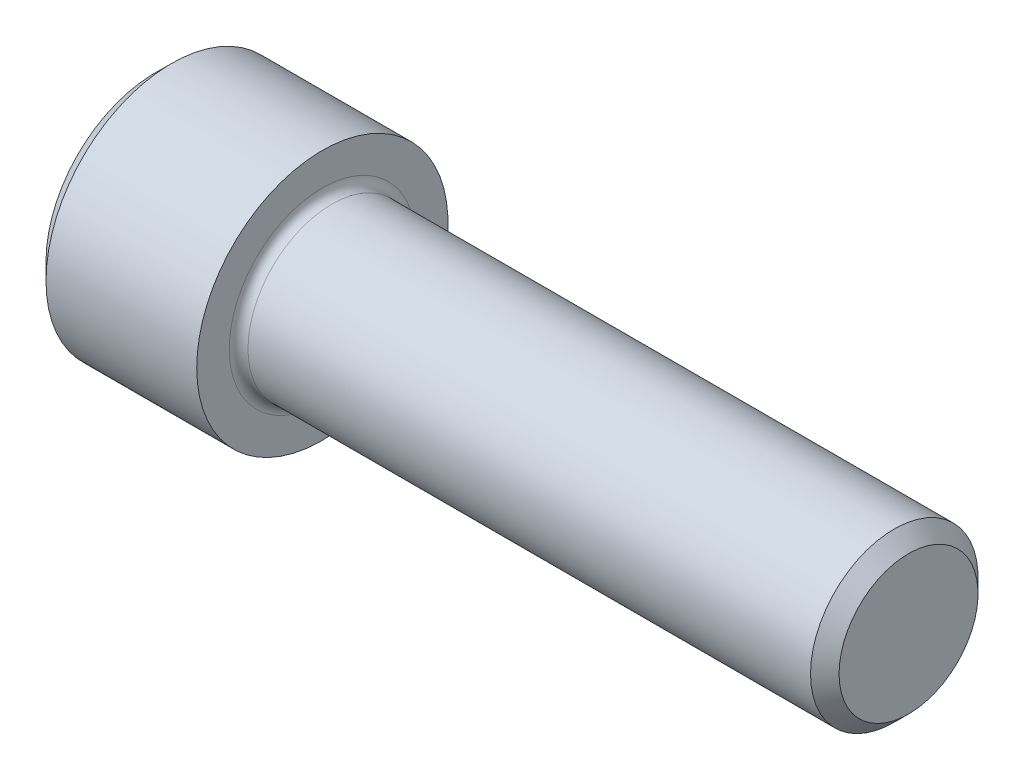
from build123d import *

# Parameters (mm, degrees)
FILLET1_R   = 0.3556
HEX_2_DEPTH = 3.048


with BuildPart() as part:
    # BodySke → Base-Revolve (revolve)
    with BuildSketch(Plane.XY, mode=Mode.PRIVATE) as base_revolve_sk:
        Polygon((0, 0), (0, 4.1275), (0.635, 4.7625), (6.35, 4.7625), (6.35, 3.175), (28.03398, 3.175), (28.575, 2.63398), (28.575, 0), align=None)
    revolve(base_revolve_sk.sketch.rotate(Axis((-31.75, 0, 0), (1, 0, 0)), 90), axis=Axis((-31.75, 0, 0), (1, 0, 0)))

    # Fillet1
    fillet1_edges = [part.edges().sort_by_distance(p)[0] for p in [
        (6.35, 0, -3.175),
    ]]
    fillet(fillet1_edges, radius=FILLET1_R)

    # Sketch2 → Hex-PreBroach (revolve, cut)
    with BuildSketch(Plane.XY, mode=Mode.PRIVATE) as hex_prebroach_sk:
        Polygon((0, 2.38125), (3.048, 2.38125), (4.422815329, 0), (0, 0), align=None)
    revolve(hex_prebroach_sk.sketch.rotate(Axis((0, 0, 0), (1, 0, 0)), 90), axis=Axis((0, 0, 0), (1, 0, 0)), mode=Mode.SUBTRACT)

    # Sketch3 → Hex 2 (cut)
    with BuildSketch(Plane(origin=(0, 0, 0), x_dir=(0, 0.500000000000001, 0.866025403784438), z_dir=(-1, 0, 0))):
        Polygon((1.374815329, 2.38125), (-1.374815329, 2.38125), (-2.749630657, 0), (-1.374815329, -2.38125), (1.374815329, -2.38125), (2.749630657, 0), align=None)
    extrude(amount=-HEX_2_DEPTH, mode=Mode.SUBTRACT)


solid = part.part
